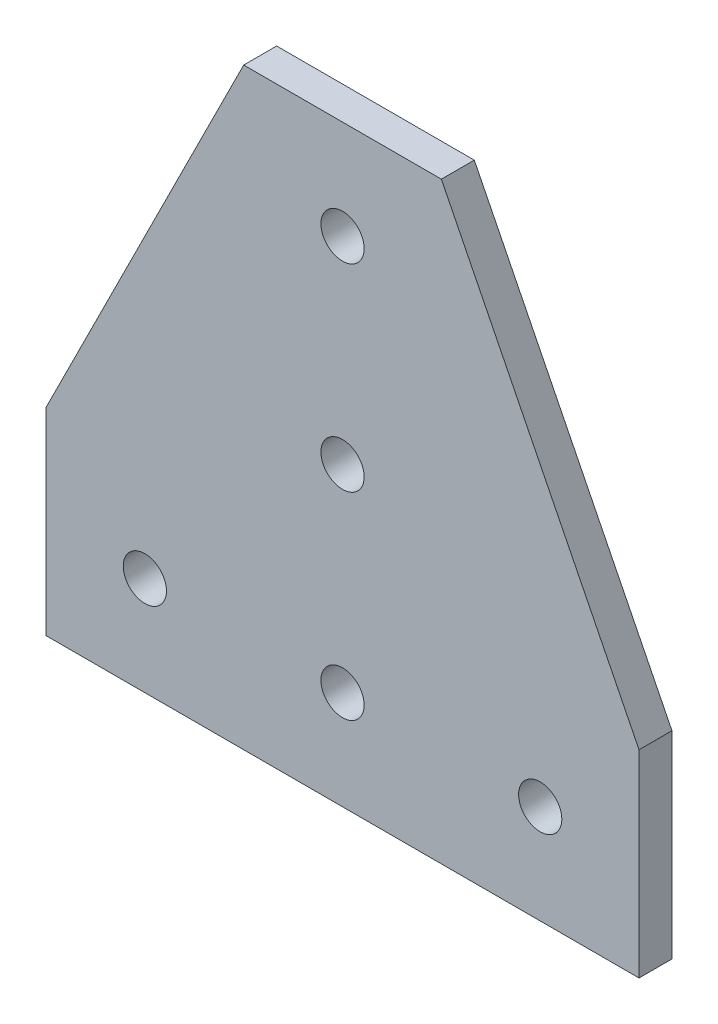
from build123d import *

# Parameters (mm, degrees)
SKETCH1_R           = 4.1656
BOSS_EXTRUDE1_DEPTH = 3.175


with BuildPart() as part:
    # Sketch1 → Boss-Extrude1 (new, symmetric)
    with BuildSketch(Plane.XY):
        Polygon((0, 0), (0, 38.1), (38.1, 114.3), (76.2, 114.3), (114.3, 38.1), (114.3, 0), align=None)
        with Locations((19.05, 19.05)):
            Circle(SKETCH1_R, mode=Mode.SUBTRACT)
        with Locations((57.15, 19.05)):
            Circle(SKETCH1_R, mode=Mode.SUBTRACT)
        with Locations((95.25, 19.05)):
            Circle(SKETCH1_R, mode=Mode.SUBTRACT)
        with Locations((57.15, 57.15)):
            Circle(SKETCH1_R, mode=Mode.SUBTRACT)
        with Locations((57.15, 95.25)):
            Circle(SKETCH1_R, mode=Mode.SUBTRACT)
    extrude(amount=BOSS_EXTRUDE1_DEPTH, both=True)


solid = part.part
